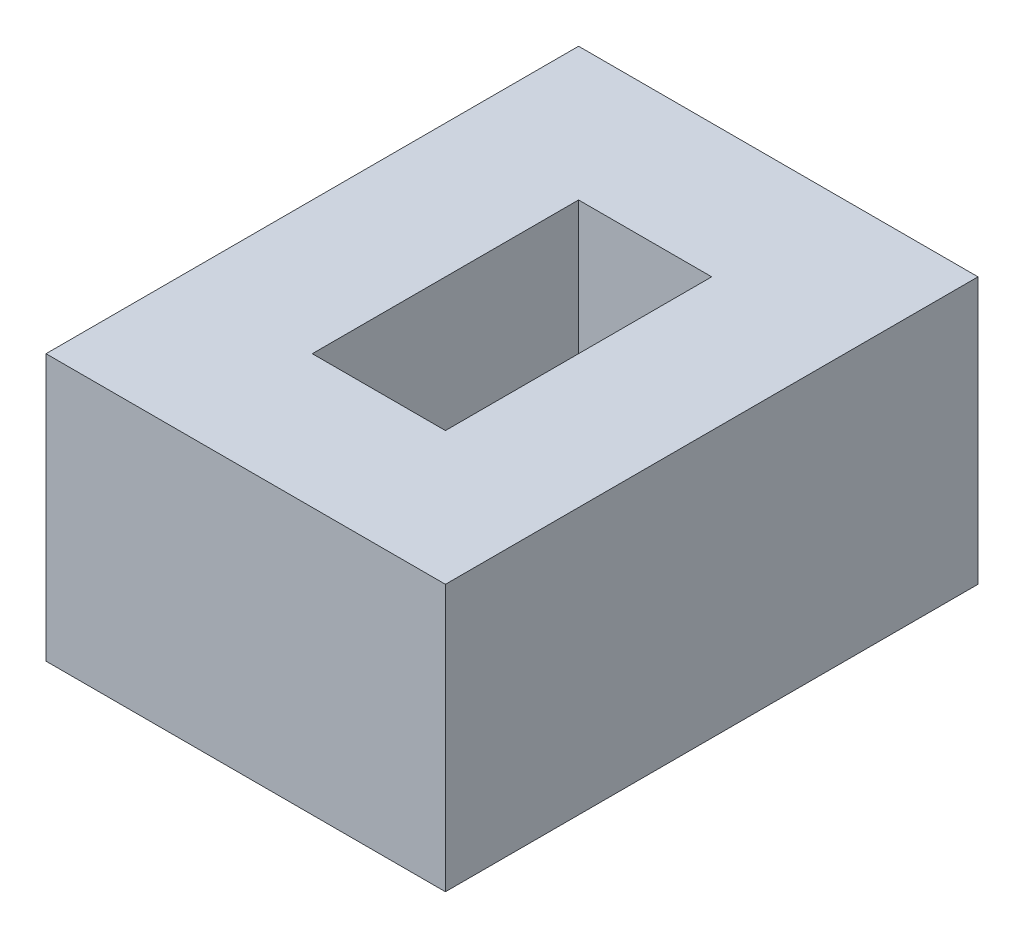
from build123d import *

# Parameters (mm, degrees)
SKETCH_1_W      = 15
SKETCH_1_H      = 20
SKETCH_1_W_2    = 5
SKETCH_1_H_2    = 10
EXTRUDE_1_DEPTH = 10


with BuildPart() as part:
    # 草图1 → 凸台-拉伸1 (new body)
    with BuildSketch(Plane(origin=(0, 0, 0), x_dir=(1, 0, 0), z_dir=(0, 1, 0))):
        with Locations((2.5, -5)):
            Rectangle(SKETCH_1_W, SKETCH_1_H)
        with Locations((2.5, -5)):
            Rectangle(SKETCH_1_W_2, SKETCH_1_H_2, mode=Mode.SUBTRACT)
    extrude(amount=EXTRUDE_1_DEPTH)


solid = part.part
